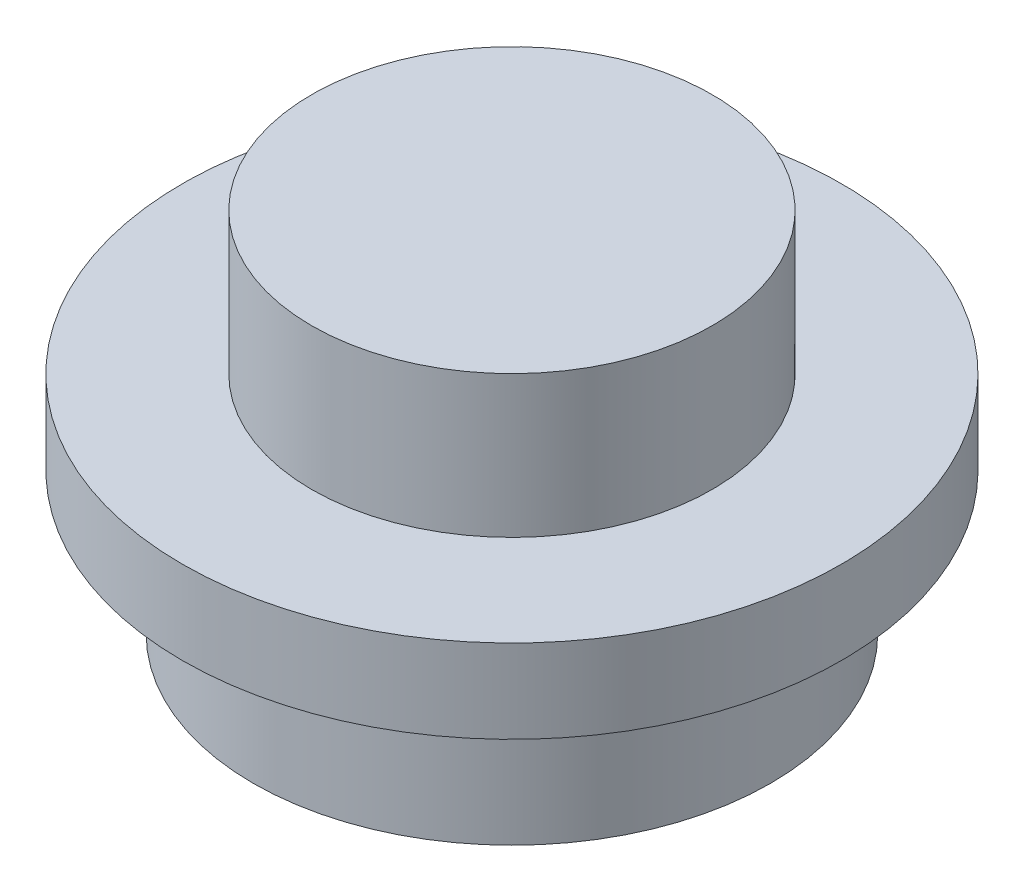
from build123d import *

# Parameters (mm, degrees)
SKETCH1_R           = 3.1
SKETCH1_R_2         = 2.4
BOSS_EXTRUDE1_DEPTH = 1.7
SKETCH2_R           = 3.95
BOSS_EXTRUDE2_DEPTH = 1
SKETCH3_R           = 2.4
BOSS_EXTRUDE3_DEPTH = 1.7


with BuildPart() as part:
    # Sketch1 → Boss-Extrude1 (new body)
    with BuildSketch(Plane(origin=(0, 0, 0), x_dir=(1, 0, 0), z_dir=(0, 1, 0))):
        with Locations(Location((0, 0, 0), (0, 0, 270))):
            Circle(SKETCH1_R)
        with Locations(Location((0, 0, 0), (0, 0, 270))):
            Circle(SKETCH1_R_2, mode=Mode.SUBTRACT)
    extrude(amount=BOSS_EXTRUDE1_DEPTH)

    # Sketch2 → Boss-Extrude2 (add)
    with BuildSketch(Plane(origin=(0, 1.7, 0), x_dir=(1, 0, 0), z_dir=(0, 1, 0))):
        with Locations(Location((0, 0, 0), (0, 0, 270))):
            Circle(SKETCH2_R)
    extrude(amount=BOSS_EXTRUDE2_DEPTH)

    # Sketch3 → Boss-Extrude3 (add)
    with BuildSketch(Plane(origin=(0, 2.7, 0), x_dir=(1, 0, 0), z_dir=(0, 1, 0))):
        with Locations(Location((0, 0, 0), (0, 0, 270))):
            Circle(SKETCH3_R)
    extrude(amount=BOSS_EXTRUDE3_DEPTH)


solid = part.part
